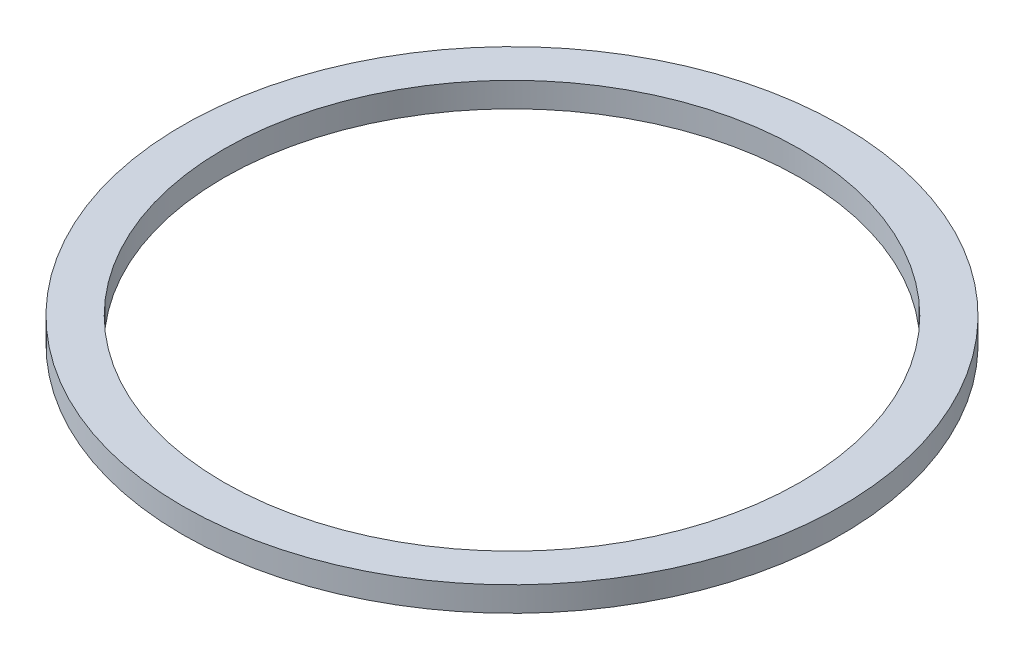
from build123d import *

# Parameters (mm, degrees)
SKETCH1_R           = 20
SKETCH1_R_2         = 17.5
BOSS_EXTRUDE1_DEPTH = 1.5


with BuildPart() as part:
    # Sketch1 → Boss-Extrude1 (new body)
    with BuildSketch(Plane(origin=(0, 0, 0), x_dir=(1, 0, 0), z_dir=(0, 1, 0))):
        Circle(SKETCH1_R)
        Circle(SKETCH1_R_2, mode=Mode.SUBTRACT)
    extrude(amount=BOSS_EXTRUDE1_DEPTH)


solid = part.part
